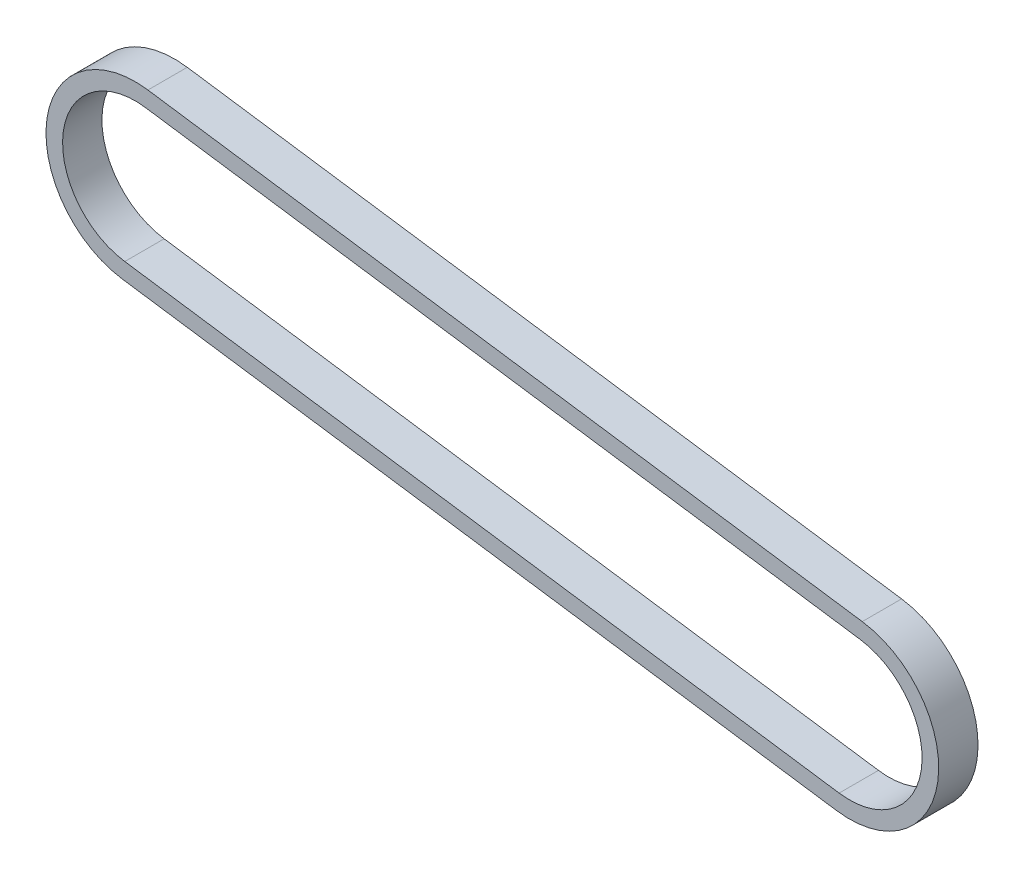
from build123d import *

# Parameters (mm, degrees)
BOSS_EXTRUDE1_DEPTH = 4.5


with BuildPart() as part:
    # Sketch2 → Boss-Extrude1 (new, symmetric)
    with BuildSketch(Plane(origin=(0, 0, 0), x_dir=(-1, 0, 0), z_dir=(0, 0, -1))):
        with BuildLine():
            Line((77.251952227, -9.452367718), (-86.151971449, -33.056768309))
            ThreePointArc((-86.151971449, -33.056768309), (-109.258996374, -15.782932628), (-91.985160693, 7.324092296))
            Line((-91.985160693, 7.324092296), (71.418762983, 30.928492887))
            ThreePointArc((71.418762983, 30.928492887), (94.525787908, 13.654657206), (77.251952227, -9.452367718))
        make_face()
        with BuildLine():
            Line((76.708664993, -5.691405211), (-86.695258683, -29.295805802))
            ThreePointArc((-86.695258683, -29.295805802), (-105.498033867, -15.239645395), (-91.44187346, 3.563129789))
            Line((-91.44187346, 3.563129789), (71.962050217, 27.16753038))
            ThreePointArc((71.962050217, 27.16753038), (90.7648254, 13.111369973), (76.708664993, -5.691405211))
        make_face(mode=Mode.SUBTRACT)
    extrude(amount=BOSS_EXTRUDE1_DEPTH, both=True)


solid = part.part
